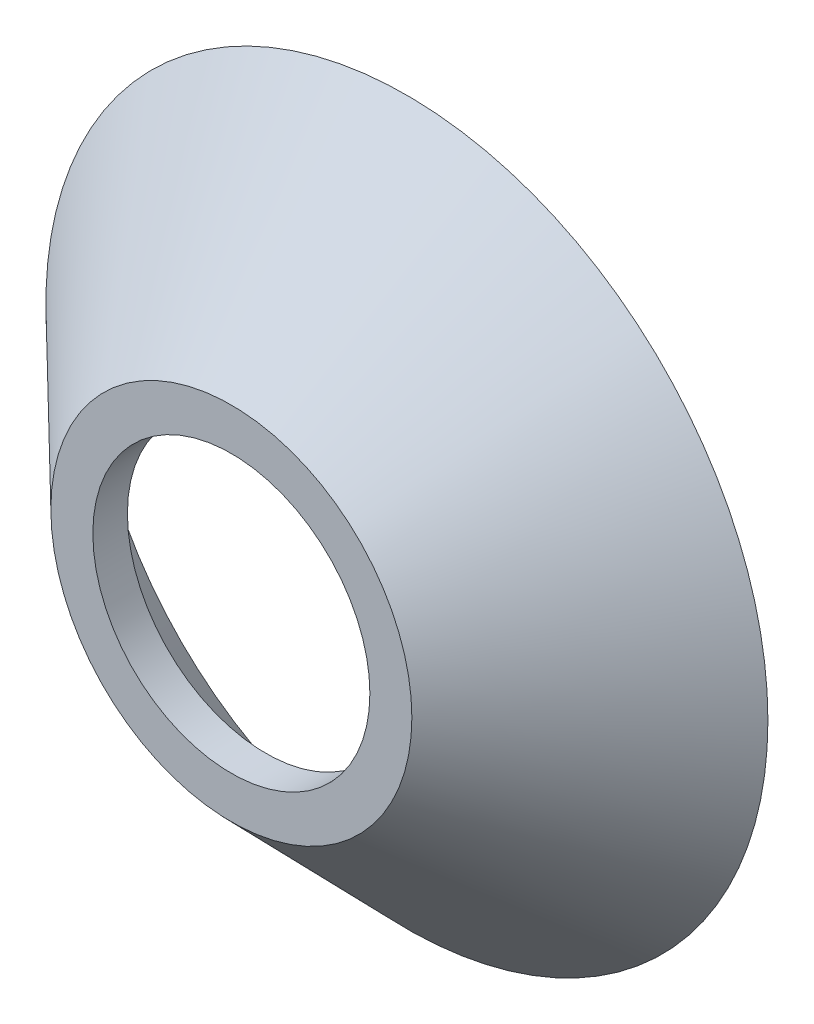
from build123d import *

# Parameters (mm, degrees)
CUT_EXTRUDE2_REACH = 77.97
SKETCH2_R          = 19.492158378


with BuildPart() as part:
    # Sketch1 → Revolve1 (revolve)
    with BuildSketch(Plane(origin=(0, 0, 0), x_dir=(1, 0, 0), z_dir=(0, 1, 0)), mode=Mode.PRIVATE) as revolve1_sk:
        Polygon((0, 0), (-25.4, 0), (-50.8, 24.70005271), (-44.857860958, 24.70005271), (-24.461420834, 4.865676877), (0, 4.865676877), align=None)
    revolve(revolve1_sk.sketch.rotate(Axis((0, 0, 0), (0, 0, -1)), 180), axis=Axis((0, 0, 0), (0, 0, -1)))

    # Sketch2 → Cut-Extrude2 (cut, up to next)
    with BuildSketch(Plane.XY, mode=Mode.PRIVATE) as cut_extrude2_sk1:
        Circle(SKETCH2_R)
    cut_extrude2_tool1 = extrude(cut_extrude2_sk1.sketch, amount=-CUT_EXTRUDE2_REACH, mode=Mode.PRIVATE) & part.part
    add(cut_extrude2_tool1.solids().sort_by_distance((0, 0, 0))[0], mode=Mode.SUBTRACT)


solid = part.part
